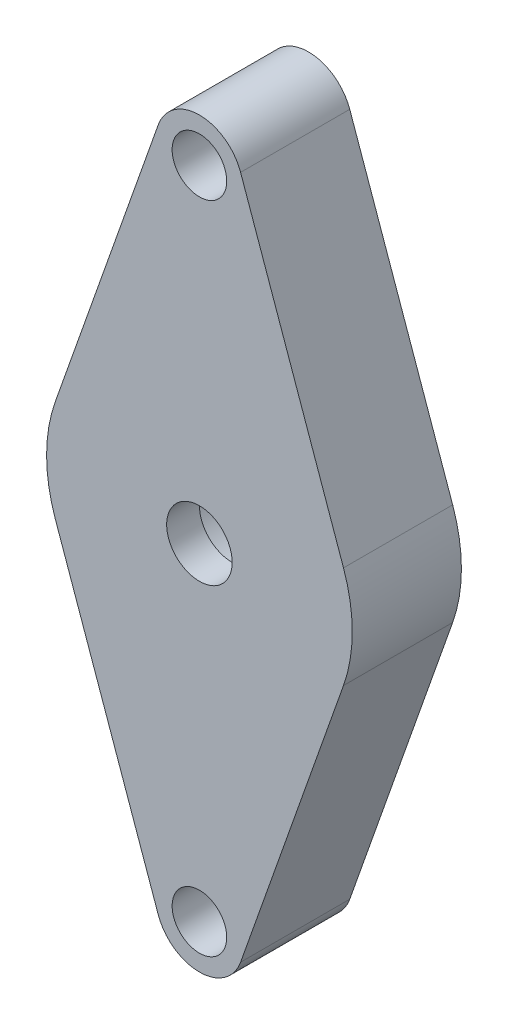
from build123d import *

# Parameters (mm, degrees)
SKETCH1_R           = 3
SKETCH1_R_2         = 1.25
BOSS_EXTRUDE1_DEPTH = 5
BOSS_EXTRUDE2_START = -1.5
SKETCH2_R           = 3
SKETCH2_R_2         = 1.5
BOSS_EXTRUDE2_DEPTH = 1.5


with BuildPart() as part:
    # Sketch1 → Boss-Extrude1 (new body)
    with BuildSketch(Plane.XY):
        with BuildLine():
            Line((-6.599663291, -2.333333333), (-1.885618083, -15.666666667))
            ThreePointArc((-1.885618083, -15.666666667), (0, -17), (1.885618083, -15.666666667))
            Line((1.885618083, -15.666666667), (6.599663291, -2.333333333))
            ThreePointArc((6.599663291, -2.333333333), (7, 0), (6.599663291, 2.333333333))
            Line((6.599663291, 2.333333333), (1.885618083, 15.666666667))
            ThreePointArc((1.885618083, 15.666666667), (0, 17), (-1.885618083, 15.666666667))
            Line((-1.885618083, 15.666666667), (-6.599663291, 2.333333333))
            ThreePointArc((-6.599663291, 2.333333333), (-7, 0), (-6.599663291, -2.333333333))
        make_face()
        Circle(SKETCH1_R, mode=Mode.SUBTRACT)
        with Locations((0, 15)):
            Circle(SKETCH1_R_2, mode=Mode.SUBTRACT)
        with Locations((0, -15)):
            Circle(SKETCH1_R_2, mode=Mode.SUBTRACT)
    extrude(amount=BOSS_EXTRUDE1_DEPTH)

    # Sketch2 → Boss-Extrude2 (add)
    with BuildSketch(Plane.XY.offset(5).offset(BOSS_EXTRUDE2_START)):
        Circle(SKETCH2_R)
        Circle(SKETCH2_R_2, mode=Mode.SUBTRACT)
    extrude(amount=BOSS_EXTRUDE2_DEPTH)


solid = part.part
